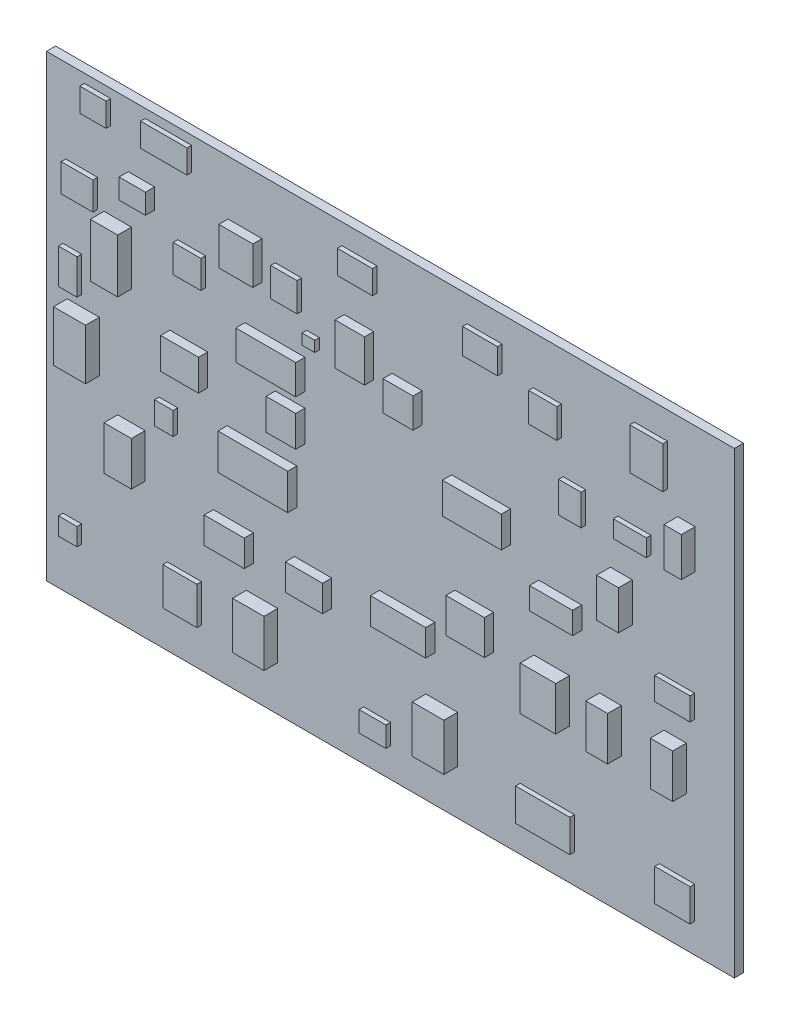
from build123d import *

# Parameters (mm, degrees)
SKETCH1_W           = 1500
SKETCH1_H           = 1000
BOSS_EXTRUDE1_DEPTH = 20
SKETCH3_W           = 130.583465718
SKETCH3_H           = 64.876118669
SKETCH3_W_2         = 151.886805153
SKETCH3_H_2         = 78.380013136
SKETCH3_W_3         = 57.534988715
SKETCH3_H_3         = 43.705768465
SKETCH3_W_4         = 74.110334533
SKETCH3_H_4         = 82.34304237
SKETCH3_W_5         = 64.654017388
SKETCH3_H_5         = 67.827502209
SKETCH3_W_6         = 64.297106784
SKETCH3_H_6         = 91.075250697
SKETCH3_W_7         = 65.482001899
SKETCH3_H_7         = 64.736542468
SKETCH3_W_8         = 82.547946155
SKETCH3_W_9         = 87.487408933
SKETCH3_H_8         = 57.683153916
SKETCH3_W_10        = 80.954123825
SKETCH3_W_11        = 120.670239475
SKETCH3_H_9         = 57.683153915
SKETCH3_W_12        = 83.987277467
SKETCH3_H_10        = 75.590177997
SKETCH3_W_13        = 128.335110014
SKETCH3_W_14        = 93.895814637
SKETCH3_H_11        = 47.906584006
BOSS_EXTRUDE3_DEPTH = 20
SKETCH4_W           = 60.505265175
SKETCH4_H           = 60.84282539
SKETCH4_W_2         = 76.713126156
SKETCH4_H_2         = 51.355111613
SKETCH4_W_3         = 57.696310853
SKETCH4_H_3         = 62.84759502
SKETCH4_W_4         = 76.226737233
SKETCH4_H_4         = 55.249628907
SKETCH4_W_5         = 61.382331515
SKETCH4_H_5         = 63.779413286
SKETCH4_W_6         = 71.885005533
SKETCH4_H_6         = 90.602849637
SKETCH4_H_7         = 37.617699495
SKETCH4_W_7         = 48.841078423
SKETCH4_H_8         = 67.384996511
SKETCH4_W_8         = 40.547503332
SKETCH4_H_9         = 49.392814631
SKETCH4_W_9         = 69.389518135
SKETCH4_W_10        = 57.1358405
SKETCH4_H_10        = 51.355111612
SKETCH4_W_11        = 101.052768507
SKETCH4_W_12        = 40.515931739
SKETCH4_H_11        = 76.411004612
SKETCH4_H_12        = 38.449288518
SKETCH4_W_13        = 76.948114593
SKETCH4_H_13        = 70.641085592
SKETCH4_W_14        = 58.340165638
SKETCH4_H_14        = 44.359686403
SKETCH4_W_15        = 74.214557021
SKETCH4_H_15        = 81.96661596
SKETCH4_W_16        = 118.257277251
SKETCH4_H_16        = 49.39281463
SKETCH4_W_17        = 27.61904506
SKETCH4_H_17        = 23.225125894
BOSS_EXTRUDE4_DEPTH = 10
SKETCH5_W           = 69.886820182
SKETCH5_H           = 110.704429614
SKETCH5_W_2         = 59.776457901
SKETCH5_H_2         = 116.965640553
SKETCH5_W_3         = 59.776457902
SKETCH5_H_3         = 95.481603563
SKETCH5_W_4         = 77.599796587
SKETCH5_W_5         = 68.98801997
SKETCH5_H_4         = 102.480565549
SKETCH5_W_6         = 68.449228886
SKETCH5_W_7         = 47.578059456
SKETCH5_H_5         = 85.302800806
SKETCH5_W_8         = 48.683008491
SKETCH5_W_9         = 37.982235028
SKETCH5_H_6         = 85.228197854
BOSS_EXTRUDE5_DEPTH = 30


with BuildPart() as part:
    # Sketch1 → Boss-Extrude1 (new body)
    with BuildSketch(Plane.XY):
        Rectangle(SKETCH1_W, SKETCH1_H)
    extrude(amount=BOSS_EXTRUDE1_DEPTH)

    # Sketch3 → Boss-Extrude3 (add)
    with BuildSketch(Plane.XY.offset(20)):
        with Locations((-251.746581796, 171.52213666)):
            Rectangle(SKETCH3_W, SKETCH3_H)
        with Locations((-279.983147389, -49.170855385)):
            Rectangle(SKETCH3_W_2, SKETCH3_H_2)
        with Locations((-542.851177133, 340.019335173)):
            Rectangle(SKETCH3_W_3, SKETCH3_H_3)
        with Locations((-317.038314656, 340.019335173)):
            Rectangle(SKETCH3_W_4, SKETCH3_H_4)
        with Locations((-218.781857631, 74.01586859)):
            Rectangle(SKETCH3_W_5, SKETCH3_H_5)
        with Locations((-68.634876688, 281.866092578)):
            Rectangle(SKETCH3_W_6, SKETCH3_H_6)
        with Locations((36.529327217, 236.328467229)):
            Rectangle(SKETCH3_W_7, SKETCH3_H_7)
        with Locations((-439.71980811, 74.01586859)):
            Rectangle(SKETCH3_W_8, SKETCH3_H_5)
        with Locations((-342.414495233, -212.465293534)):
            Rectangle(SKETCH3_W_9, SKETCH3_H_8)
        with Locations((-168.530590972, -212.465293534)):
            Rectangle(SKETCH3_W_10, SKETCH3_H_8)
        with Locations((36.529327217, -183.623716577)):
            Rectangle(SKETCH3_W_11, SKETCH3_H_9)
        with Locations((182.83360839, -109.875086681)):
            Rectangle(SKETCH3_W_12, SKETCH3_H_10)
        with Locations((197.567359377, 107.929619695)):
            Rectangle(SKETCH3_W_13, SKETCH3_H_5)
        with Locations((370.308737898, 13.972443186)):
            Rectangle(SKETCH3_W_14, SKETCH3_H_11)
    extrude(amount=BOSS_EXTRUDE3_DEPTH)

    # Sketch4 → Boss-Extrude4 (add)
    with BuildSketch(Plane.XY.offset(20)):
        with Locations((-433.57041273, 256.853926164)):
            Rectangle(SKETCH4_W, SKETCH4_H)
        with Locations((-67.526645897, 429.414434023)):
            Rectangle(SKETCH4_W_2, SKETCH4_H_2)
        with Locations((-222.402612467, 318.699136369)):
            Rectangle(SKETCH4_W_3, SKETCH4_H_3)
        with Locations((205.349756633, 416.444675835)):
            Rectangle(SKETCH4_W_4, SKETCH4_H_4)
        with Locations((342.079165749, 363.534652055)):
            Rectangle(SKETCH4_W_5, SKETCH4_H_5)
        with Locations((567.90495485, 395.424358697)):
            Rectangle(SKETCH4_W_6, SKETCH4_H_6)
        with Locations((531.962452085, 226.43251347)):
            Rectangle(SKETCH4_W_6, SKETCH4_H_7)
        with Locations((401.207804375, 226.43251347)):
            Rectangle(SKETCH4_W_7, SKETCH4_H_8)
        with Locations((-484.096796983, -54.894187693)):
            Rectangle(SKETCH4_W_8, SKETCH4_H_9)
        with Locations((-673.360372997, 287.275338859)):
            Rectangle(SKETCH4_W_9, SKETCH4_H)
        with Locations((-638.665613929, 455.091989829)):
            Rectangle(SKETCH4_W_10, SKETCH4_H_10)
        with Locations((-484.096796983, 455.091989829)):
            Rectangle(SKETCH4_W_11, SKETCH4_H_10)
        with Locations((-693.618338867, 117.106041113)):
            Rectangle(SKETCH4_W_12, SKETCH4_H_11)
        with Locations((-693.618338867, -373.3681612)):
            Rectangle(SKETCH4_W_12, SKETCH4_H_12)
        with Locations((624.860370913, -401.210769585)):
            Rectangle(SKETCH4_W_13, SKETCH4_H_13)
        with Locations((-29.170082819, -414.351469179)):
            Rectangle(SKETCH4_W_14, SKETCH4_H_14)
        with Locations((-449.070136402, -373.3681612)):
            Rectangle(SKETCH4_W_15, SKETCH4_H_15)
        with Locations((342.079165749, -401.210769585)):
            Rectangle(SKETCH4_W_16, SKETCH4_H_13)
        with Locations((624.860370913, -30.197780377)):
            Rectangle(SKETCH4_W_13, SKETCH4_H_16)
        with Locations((-168.845215562, 245.241363217)):
            Rectangle(SKETCH4_W_17, SKETCH4_H_17)
    extrude(amount=BOSS_EXTRUDE4_DEPTH)

    # Sketch5 → Boss-Extrude5 (add)
    with BuildSketch(Plane.XY.offset(20)):
        with Locations((-669.689782814, 0)):
            Rectangle(SKETCH5_W, SKETCH5_H)
        with Locations((-594.606430914, 202.16224879)):
            Rectangle(SKETCH5_W_2, SKETCH5_H_2)
        with Locations((-564.718201963, -156.448979485)):
            Rectangle(SKETCH5_W_3, SKETCH5_H_3)
        with Locations((351.696943904, -156.448979485)):
            Rectangle(SKETCH5_W_4, SKETCH5_H_3)
        with Locations((112.072703345, -351.196361502)):
            Rectangle(SKETCH5_W_5, SKETCH5_H_4)
        with Locations((-279.921964377, -351.196361502)):
            Rectangle(SKETCH5_W_6, SKETCH5_H_4)
        with Locations((503.549963007, 98.00361521)):
            Rectangle(SKETCH5_W_7, SKETCH5_H_5)
        with Locations((479.760933279, -156.448979485)):
            Rectangle(SKETCH5_W_7, SKETCH5_H_3)
        with Locations((621.042297234, -156.448979485)):
            Rectangle(SKETCH5_W_8, SKETCH5_H_3)
        with Locations((645.38380148, 266.83756344)):
            Rectangle(SKETCH5_W_9, SKETCH5_H_6)
    extrude(amount=BOSS_EXTRUDE5_DEPTH)


solid = part.part
